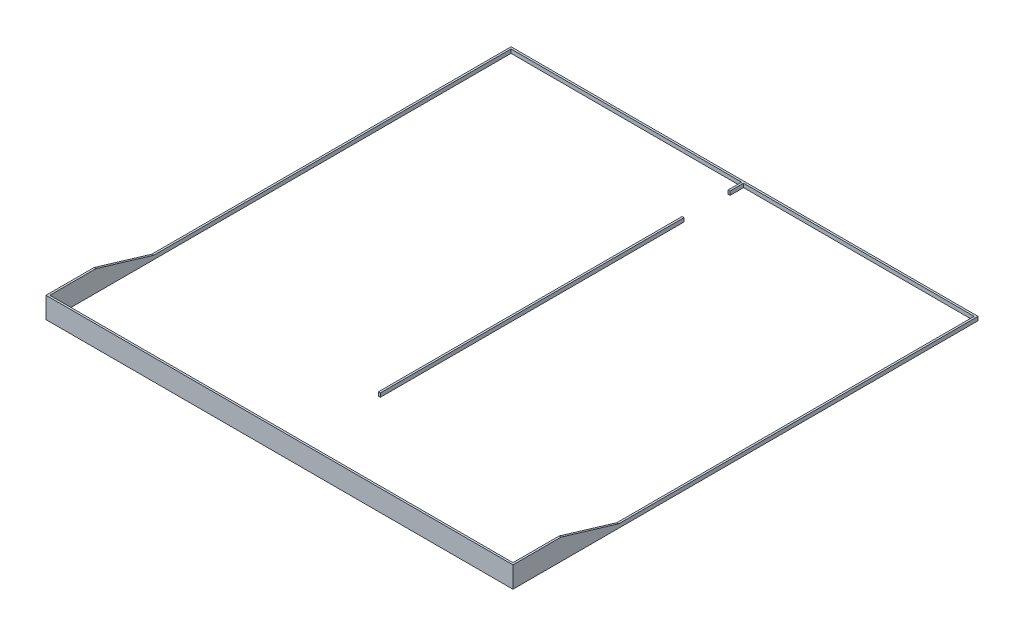
from build123d import *

# Parameters (mm, degrees)
SKETCH_1_W          = 12150
SKETCH_1_H          = 12100
EXTRUDE_1_DEPTH     = 550
SKETCH_1_W_2        = 50
SKETCH_1_H_2        = 7900
EXTRUDE_1_2_DEPTH   = 550
CUT_EXTRUDE_1_DEPTH = 13585.089958477
SKETCH_3_W          = 7900
SKETCH_3_H          = 450
CUT_EXTRUDE_2_DEPTH = 8610.006911369


with BuildPart() as part:
    # 草图1 → 凸台-拉伸1 (new body)
    with BuildSketch(Plane(origin=(0, 0, 0), x_dir=(1, 0, 0), z_dir=(0, 1, 0))):
        Rectangle(SKETCH_1_W, SKETCH_1_H)
        Polygon((6025, -6000), (6025, 6000), (25, 6000), (25, 5650), (-25, 5650), (-25, 6000), (-6025, 6000), (-6025, -6000), align=None, mode=Mode.SUBTRACT)
    extrude(amount=EXTRUDE_1_DEPTH)

    # 草图2 → 切除-拉伸1 (cut, through all)
    with BuildSketch(Plane(origin=(6075, 0, 0), x_dir=(0, 0, -1), z_dir=(1, 0, 0))):
        Polygon((-4800, 550), (-3300, 100), (6050, 100), (6050, 550), align=None)
    extrude(amount=-CUT_EXTRUDE_1_DEPTH, mode=Mode.SUBTRACT)


with BuildPart() as body_2:
    # 草图1 → Extrude 1 2 (new body)
    with BuildSketch(Plane(origin=(0, 0, 0), x_dir=(1, 0, 0), z_dir=(0, 1, 0))):
        with Locations((0, 500)):
            Rectangle(SKETCH_1_W_2, SKETCH_1_H_2)
    extrude(amount=EXTRUDE_1_2_DEPTH)

    # 草图3 → 切除-拉伸2 (cut, through all)
    with BuildSketch(Plane.ZY.offset(25)):
        with Locations((-500, 325)):
            Rectangle(SKETCH_3_W, SKETCH_3_H)
    extrude(amount=-CUT_EXTRUDE_2_DEPTH, mode=Mode.SUBTRACT)


solid = Compound([part.part, body_2.part])
